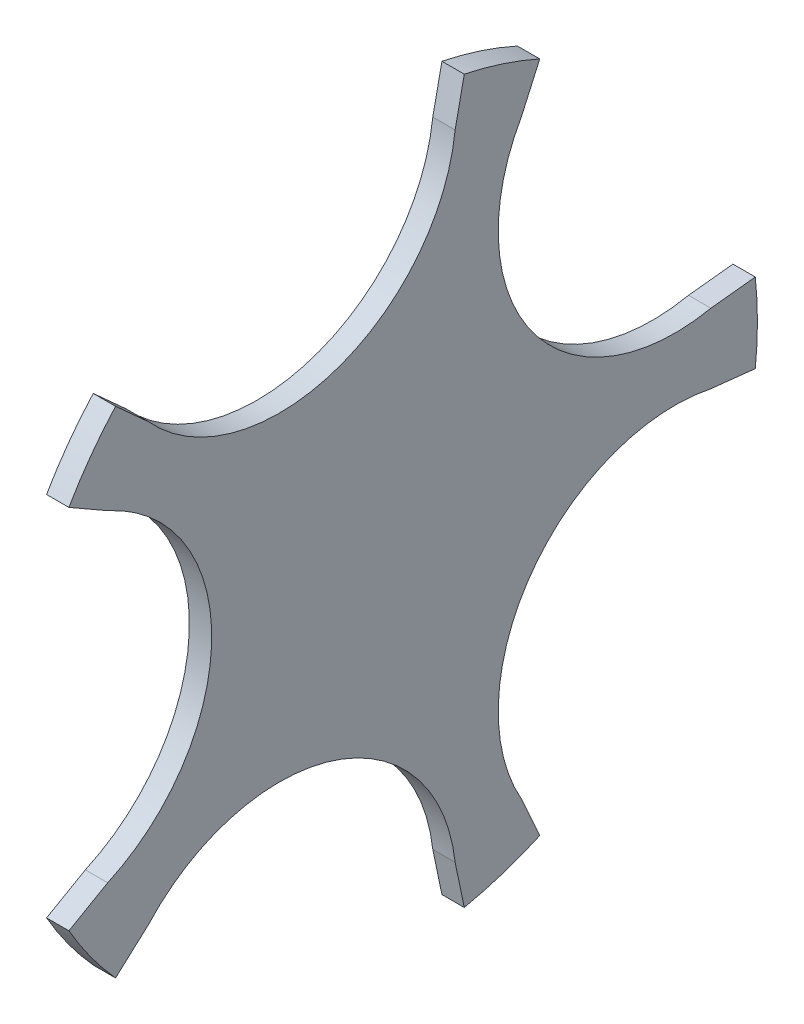
from build123d import *

# Parameters (mm, degrees)
ESTRUSIONE_ESTRUSIONE1_DEPTH = 0.5


with BuildPart() as part:
    # Schizzo1 → Estrusione-Estrusione1 (new body)
    with BuildSketch(Plane(origin=(7.692307692, 0, 0), x_dir=(0, 0, -1), z_dir=(1, 0, 0))):
        with BuildLine():
            Line((-6.113475279, -5.539667861), (-5.372640914, -4.868367801))
            ThreePointArc((-5.372640914, -4.868367801), (-1.224247655, -3.767846854), (1.485003008, -7.096551381))
            Line((1.485003008, -7.096551381), (1.689770324, -8.075096052))
            ThreePointArc((1.689770324, -8.075096052), (2.549390204, -7.846216259), (3.379369462, -7.526112014))
            Line((3.379369462, -7.526112014), (2.969855574, -6.614093536))
            ThreePointArc((2.969855574, -6.614093536), (3.205121972, -2.32865742), (7.2081126, -0.780633191))
            Line((7.2081126, -0.780633191), (8.202040467, -0.888274834))
            ThreePointArc((8.202040467, -0.888274834), (8.25, 0), (8.202040467, 0.888274834))
            Line((8.202040467, 0.888274834), (7.2081126, 0.780633191))
            ThreePointArc((7.2081126, 0.780633191), (3.205121972, 2.32865742), (2.969855574, 6.614093536))
            Line((2.969855574, 6.614093536), (3.379369462, 7.526112014))
            ThreePointArc((3.379369462, 7.526112014), (2.549390204, 7.846216259), (1.689770324, 8.075096052))
            Line((1.689770324, 8.075096052), (1.485003008, 7.096551381))
            ThreePointArc((1.485003008, 7.096551381), (-1.224247655, 3.767846854), (-5.372640914, 4.868367801))
            Line((-5.372640914, 4.868367801), (-6.113475279, 5.539667861))
            ThreePointArc((-6.113475279, 5.539667861), (-6.674390204, 4.849228331), (-7.157704974, 4.102408989))
            Line((-7.157704974, 4.102408989), (-6.290330268, 3.605276765))
            ThreePointArc((-6.290330268, 3.605276765), (-3.961748634, 0), (-6.290330268, -3.605276765))
            Line((-6.290330268, -3.605276765), (-7.157704974, -4.102408989))
            ThreePointArc((-7.157704974, -4.102408989), (-6.674390204, -4.849228331), (-6.113475279, -5.539667861))
        make_face()
    extrude(amount=-ESTRUSIONE_ESTRUSIONE1_DEPTH)


solid = part.part
